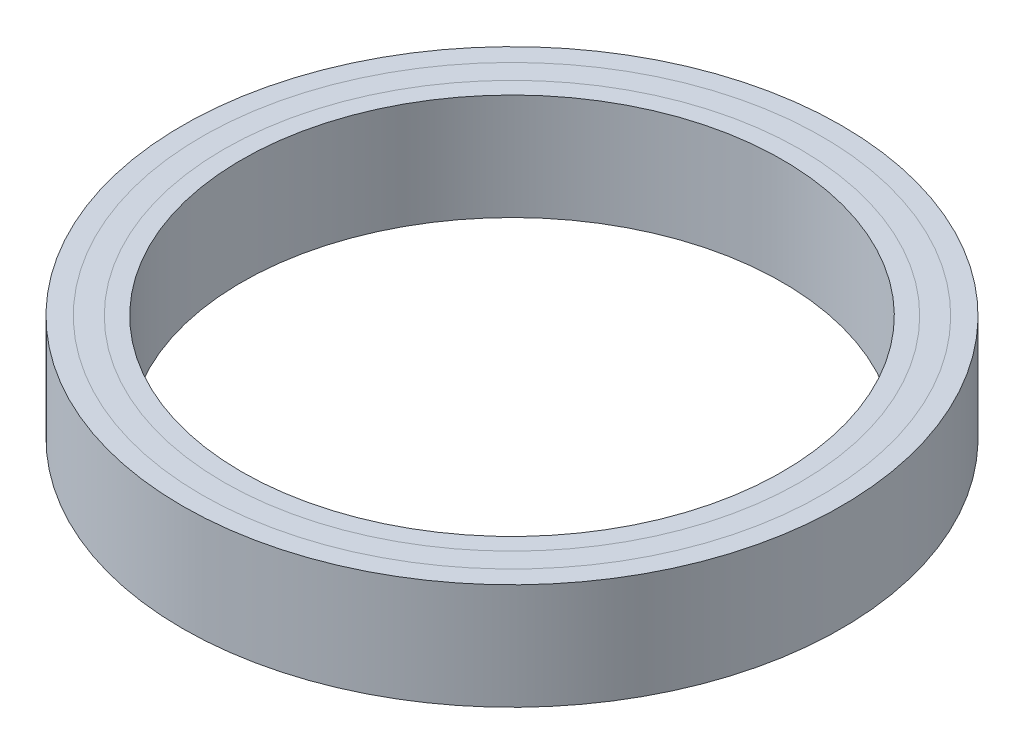
from build123d import *

# Parameters (mm, degrees)
BOSS_EXTRUDE1_START = 3
SKETCH2_R           = 21.737647639
SKETCH2_R_2         = 20.383469786
BOSS_EXTRUDE1_DEPTH = 8
BOSS_EXTRUDE2_START = 3
SKETCH5_R           = 24.848113281
SKETCH5_R_2         = 23.389804227
BOSS_EXTRUDE2_DEPTH = 8
SKETCH6_R           = 23.389804227
SKETCH6_R_2         = 21.737647639
BOSS_EXTRUDE3_DEPTH = 8


with BuildPart() as part:
    # Sketch2 → Boss-Extrude1 (new body)
    with BuildSketch(Plane(origin=(0, 0, 0), x_dir=(1, 0, 0), z_dir=(0, 1, 0)).offset(BOSS_EXTRUDE1_START)):
        with Locations(Location((0, 0, 0), (0, 0, 270))):
            Circle(SKETCH2_R)
        with Locations(Location((0, 0, 0), (0, 0, 270))):
            Circle(SKETCH2_R_2, mode=Mode.SUBTRACT)
    extrude(amount=BOSS_EXTRUDE1_DEPTH)


with BuildPart() as body_2:
    # Sketch5 → Boss-Extrude2 (new body)
    with BuildSketch(Plane(origin=(0, 0, 0), x_dir=(1, 0, 0), z_dir=(0, 1, 0)).offset(BOSS_EXTRUDE2_START)):
        with Locations(Location((0, 0, 0), (0, 0, 270))):
            Circle(SKETCH5_R)
        with Locations(Location((0, 0, 0), (0, 0, 270))):
            Circle(SKETCH5_R_2, mode=Mode.SUBTRACT)
    extrude(amount=BOSS_EXTRUDE2_DEPTH)


with BuildPart() as body_3:
    # Sketch6 → Boss-Extrude3 (new body)
    with BuildSketch(Plane(origin=(0, 11, 0), x_dir=(1, 0, 0), z_dir=(0, 1, 0))):
        with Locations(Location((0, 0, 0), (0, 0, 270))):
            Circle(SKETCH6_R)
        with Locations(Location((0, 0, 0), (0, 0, 270))):
            Circle(SKETCH6_R_2, mode=Mode.SUBTRACT)
    extrude(amount=-BOSS_EXTRUDE3_DEPTH)


solid = Compound([part.part, body_2.part, body_3.part])
